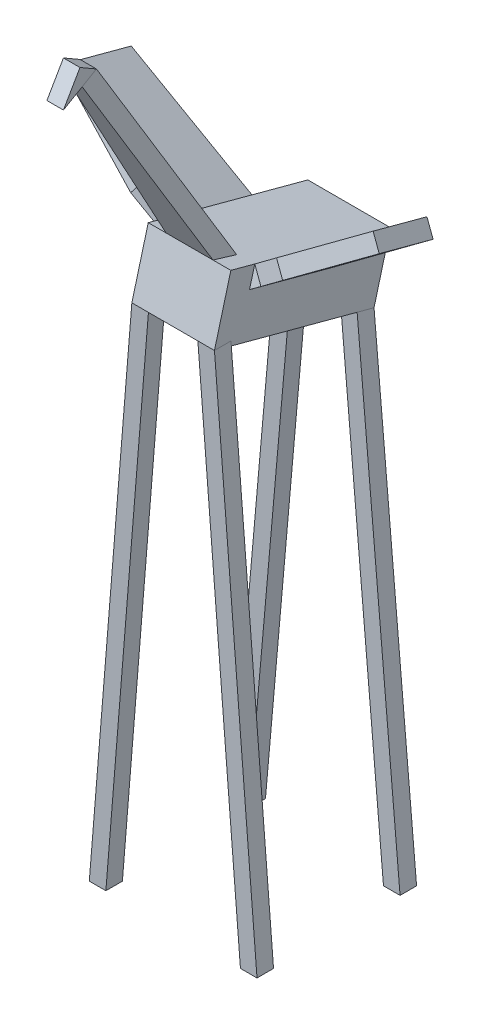
from build123d import *

# Parameters (mm, degrees)
SKETCH9_W            = 762
SKETCH9_H            = 584.514480793
BOSS_EXTRUDE6_DEPTH  = 1524
BOSS_EXTRUDE7_DEPTH  = 152.4
BOSS_EXTRUDE8_DEPTH  = 152.4
BOSS_EXTRUDE11_DEPTH = 76.2
BOSS_EXTRUDE9_DEPTH  = 152.4
BOSS_EXTRUDE10_DEPTH = 152.4


with BuildPart() as part:
    # Sketch9 → Boss-Extrude6 (new body)
    with BuildSketch(Plane(origin=(0, 360.490957412, 1345.370568731), x_dir=(1, 0, 0), z_dir=(0, 0.25881904510252135, 0.9659258262890681))):
        with Locations((0, 4905.855472671)):
            Rectangle(SKETCH9_W, SKETCH9_H)
    extrude(amount=-BOSS_EXTRUDE6_DEPTH)

    # Sketch3 → Boss-Extrude7 (add)
    with BuildSketch(Plane(origin=(-2331.096675302, 3146.053127226, -842.982394786), x_dir=(0.8131847216037706, 0.5621743148677428, -0.15063415367433172), z_dir=(-0.5820056774209321, 0.785476124140768, -0.2104676931374475))):
        Polygon((3335.15448981, -1164.230103632), (3619.536761347, -1240.430103632), (4543.811009791, -1240.430103632), (4543.811009791, -726.088642088), (3335.15448981, -402.230103632), (3182.75448981, -402.230103632), (3182.75448981, -1164.230103632), align=None)
    boss_extrude7 = extrude(amount=-BOSS_EXTRUDE7_DEPTH)

    # Mirror1: Boss-Extrude7 across plane
    add(boss_extrude7.mirror(Plane(origin=(0, 0, 0), x_dir=(0, 0, 1), z_dir=(1, 0, 0))))

    # Sketch4 → Boss-Extrude8 (add)
    with BuildSketch(Plane(origin=(0, 1345.370568731, -2330.250180051), x_dir=(1, 0, 0), z_dir=(0, -0.500000000000001, 0.866025403784438))):
        Polygon((-216.36773556, 4660.500360101), (-76.2, 6794.100360101), (76.2, 6794.100360101), (216.36773556, 4660.500360101), (226.379716672, 4508.100360101), (-226.379716672, 4508.100360101), align=None)
    extrude(amount=-BOSS_EXTRUDE8_DEPTH)

    # Sketch13 → Boss-Extrude11 (add, symmetric)
    with BuildSketch(Plane(origin=(0, 0, 0), x_dir=(0, 0, -1), z_dir=(1, 0, 0))):
        Polygon((-934.817728463, 7305.43407644), (-1239.617728463, 7129.457714391), (-1087.217728463, 7393.422257464), align=None)
    extrude(amount=BOSS_EXTRUDE11_DEPTH, both=True)

    # Sketch10 → Boss-Extrude9 (add)
    with BuildSketch(Plane.XY.offset(151.283479767)):
        Polygon((-381, 4816.884642088), (-773.558553377, 0), (-620.653296714, 0), (-228.094743337, 4816.884642088), align=None)
        Polygon((773.558553377, 0), (381, 4816.884642088), (228.094743337, 4816.884642088), (620.653296714, 0), align=None)
    extrude(amount=-BOSS_EXTRUDE9_DEPTH)

    # Sketch12 → Boss-Extrude10 (add)
    with BuildSketch(Plane.XY.offset(-1320.787479497)):
        Polygon((381, 4422.444417351), (773.558553377, 0), (620.559333608, 0), (228.00078023, 4422.444417351), (214.472984765, 4574.844417351), (367.472204535, 4574.844417351), align=None)
        Polygon((-773.558553377, 0), (-381, 4422.444417351), (-367.472204535, 4574.844417351), (-214.472984765, 4574.844417351), (-228.00078023, 4422.444417351), (-620.559333608, 0), align=None)
    extrude(amount=BOSS_EXTRUDE10_DEPTH)


solid = part.part
